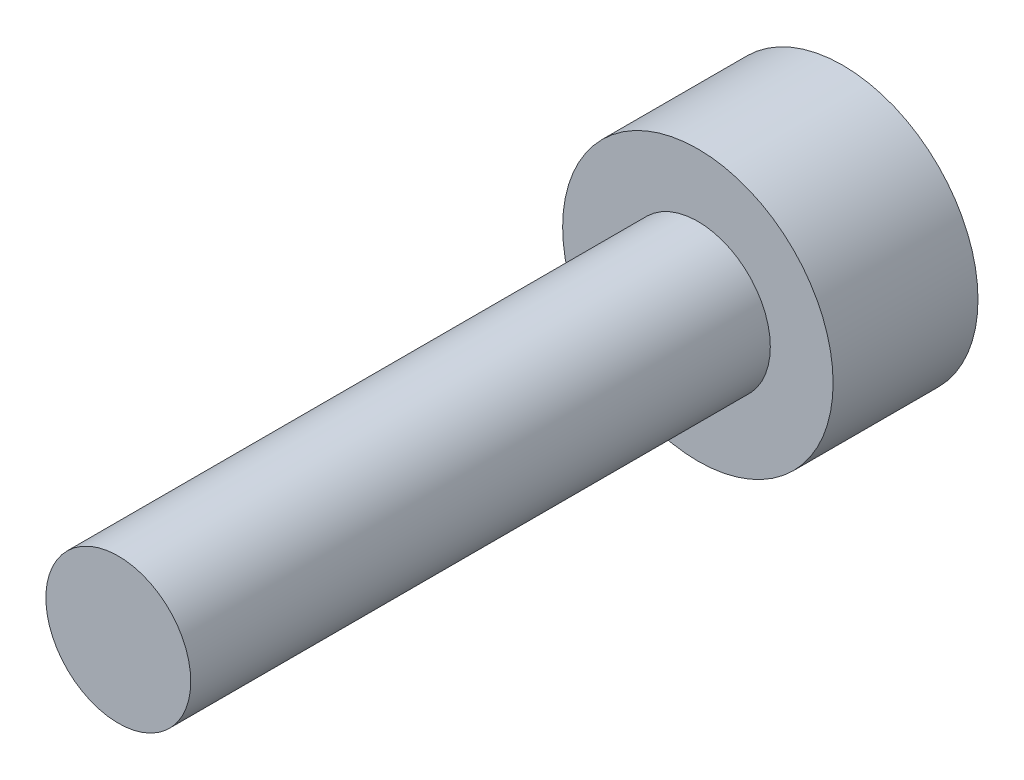
from build123d import *

# Parameters (mm, degrees)
HEAD_START       = -3
SKETCH1_R        = 2.8
HEAD_DEPTH       = 3
SKETCH2_R        = 1.5
SHANK_DEPTH      = 12
HEX_START        = -3.2
HEX_SOCKET_DEPTH = 1.8


with BuildPart() as part:
    # Sketch1 → Head (new body)
    with BuildSketch(Plane.XY.offset(HEAD_START)):
        Circle(SKETCH1_R)
    extrude(amount=HEAD_DEPTH)

    # Sketch2 → Shank (add)
    with BuildSketch(Plane.XY):
        Circle(SKETCH2_R)
    extrude(amount=SHANK_DEPTH)

    # Sketch3 → Hex socket (cut)
    with BuildSketch(Plane.XY.offset(HEX_START)):
        Polygon((1.25, 0.721687836), (0, 1.443375673), (-1.25, 0.721687836), (-1.25, -0.721687836), (0, -1.443375673), (1.25, -0.721687836), align=None)
    extrude(amount=HEX_SOCKET_DEPTH, mode=Mode.SUBTRACT)


solid = part.part
